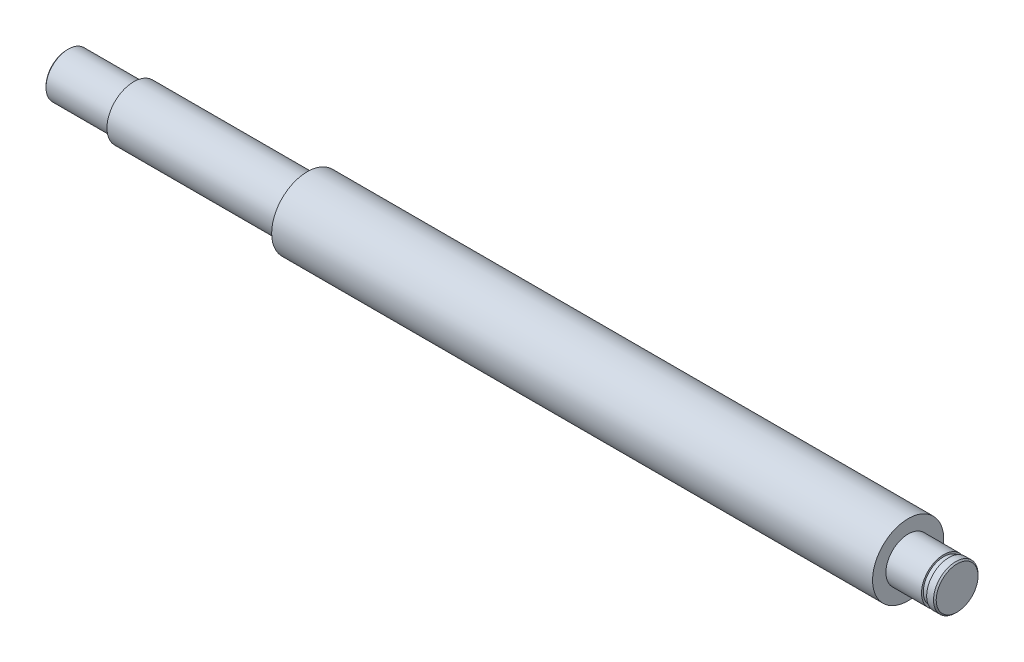
from build123d import *

# Parameters (mm, degrees)
SKETCH_2_W     = 1.15
SKETCH_2_H     = 0.4
CHAMFER_1_SIZE = 0.3


with BuildPart() as part:
    # Эскиз1 → Повернуть1 (revolve)
    with BuildSketch(Plane.XY):
        Polygon((-100, 0), (100, 0), (100, 5), (89, 5), (89, 8), (-46, 8), (-46, 6), (-85, 6), (-85, 5), (-100, 5), align=None)
    revolve(axis=Axis((-100, 0, 0), (1, 0, 0)))

    # Эскиз2 → Вырез-Повернуть1 (revolve, cut)
    with BuildSketch(Plane.XY):
        with Locations((97.575, 4.8)):
            Rectangle(SKETCH_2_W, SKETCH_2_H)
    revolve(axis=Axis((89, 0, 0), (1, 0, 0)), mode=Mode.SUBTRACT)

    # Фаска1
    chamfer_1_edges = [part.edges().sort_by_distance(p)[0] for p in [
        (-100, -5, 0),
        (100, -5, 0),
    ]]
    chamfer(chamfer_1_edges, length=CHAMFER_1_SIZE)


solid = part.part
